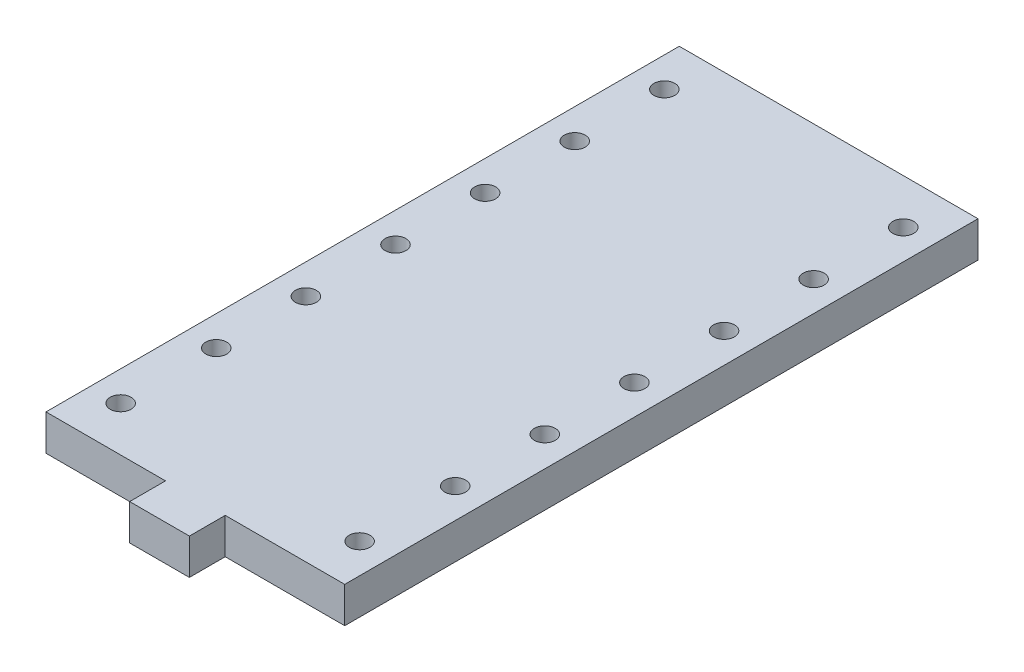
from build123d import *

# Parameters (mm, degrees)
ESBO_O1_W                = 50
ESBO_O1_H                = 112
RESSALTO_EXTRUS_O1_DEPTH = 6
ESBO_O2_W                = 20
ESBO_O2_H                = 6
CORTE_EXTRUS_O1_DEPTH    = 6
ESBO_O5_R                = 1.75
CORTE_EXTRUS_O3_DEPTH    = 6


with BuildPart() as part:
    # Esboço1 → Ressalto-extrusão1 (new body)
    with BuildSketch(Plane(origin=(0, 0, 0), x_dir=(1, 0, 0), z_dir=(0, 1, 0))):
        with Locations((-22.136094675, 56)):
            Rectangle(ESBO_O1_W, ESBO_O1_H)
    extrude(amount=RESSALTO_EXTRUS_O1_DEPTH)

    # Esboço2 → Corte-extrusão1 (cut)
    with BuildSketch(Plane.XY):
        with Locations((-37.136094675, 3)):
            Rectangle(ESBO_O2_W, ESBO_O2_H)
        with Locations((-7.136094675, 3)):
            Rectangle(ESBO_O2_W, ESBO_O2_H)
    extrude(amount=-CORTE_EXTRUS_O1_DEPTH, mode=Mode.SUBTRACT)

    # Esboço5 → Corte-extrusão3 (cut)
    with BuildSketch(Plane(origin=(0, 6, 0), x_dir=(1, 0, 0), z_dir=(0, 1, 0))):
        with Locations(Location((-42.136094675, 104.5, 0), (0, 0, 270))):
            Circle(ESBO_O5_R)
        with Locations(Location((-42.136094675, 89.5, 0), (0, 0, 270))):
            Circle(ESBO_O5_R)
        with Locations(Location((-42.136094675, 74.5, 0), (0, 0, 270))):
            Circle(ESBO_O5_R)
        with Locations(Location((-42.136094675, 59.5, 0), (0, 0, 270))):
            Circle(ESBO_O5_R)
        with Locations(Location((-42.136094675, 44.5, 0), (0, 0, 270))):
            Circle(ESBO_O5_R)
        with Locations(Location((-42.136094675, 13.5, 0), (0, 0, 270))):
            Circle(ESBO_O5_R)
        with Locations(Location((-42.136094675, 29.5, 0), (0, 0, 270))):
            Circle(ESBO_O5_R)
        with Locations(Location((-2.136094675, 104.491725396, 0), (0, 0, 270))):
            Circle(ESBO_O5_R)
        with Locations(Location((-2.136094675, 89.491725396, 0), (0, 0, 270))):
            Circle(ESBO_O5_R)
        with Locations(Location((-2.136094675, 74.491725396, 0), (0, 0, 270))):
            Circle(ESBO_O5_R)
        with Locations(Location((-2.136094675, 59.491725396, 0), (0, 0, 270))):
            Circle(ESBO_O5_R)
        with Locations(Location((-2.136094675, 44.491725396, 0), (0, 0, 270))):
            Circle(ESBO_O5_R)
        with Locations(Location((-2.136094675, 13.491725396, 0), (0, 0, 270))):
            Circle(ESBO_O5_R)
        with Locations(Location((-2.136094675, 29.491725396, 0), (0, 0, 270))):
            Circle(ESBO_O5_R)
    extrude(amount=-CORTE_EXTRUS_O3_DEPTH, mode=Mode.SUBTRACT)


solid = part.part
